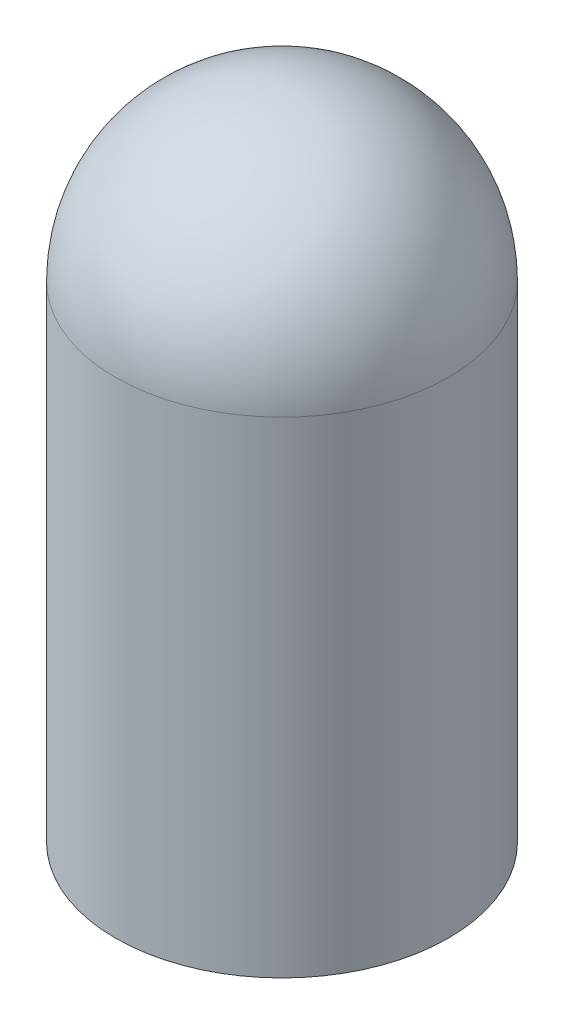
from build123d import *


with BuildPart() as part:
    # Sketch1 → Revolve1 (revolve)
    with BuildSketch(Plane.XY):
        with BuildLine():
            Line((12, 0), (12, -35))
            Line((12, -35), (10.5, -35))
            Line((10.5, -35), (10.5, 0))
            ThreePointArc((10.5, 0), (7.424621202, 7.424621202), (0, 10.5))
            Line((0, 10.5), (0, 12))
            ThreePointArc((0, 12), (8.485281374, 8.485281374), (12, 0))
        make_face()
    revolve(axis=Axis((0, 12, 0), (0, -1, 0)))


solid = part.part
